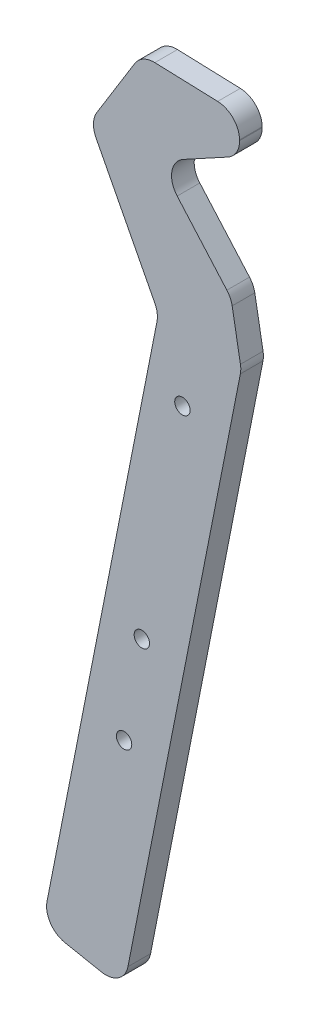
from build123d import *

# Parameters (mm, degrees)
SKETCH1_R           = 1.7
BOSS_EXTRUDE1_DEPTH = 5


with BuildPart() as part:
    # Sketch1 → Boss-Extrude1 (new body)
    with BuildSketch(Plane.XY):
        with BuildLine():
            Line((-6.070464182, 24.812225303), (-19.958071354, 25.288330369))
            ThreePointArc((-19.958071354, 25.288330369), (-22.490276705, 24.698780913), (-24.384131469, 22.917504226))
            Line((-24.384131469, 22.917504226), (-32.767669467, 9.335402505))
            ThreePointArc((-32.767669467, 9.335402505), (-33.509344938, 6.898271001), (-32.954010567, 4.412049729))
            Line((-32.954010567, 4.412049729), (-19.944783446, -20.739122704))
            ThreePointArc((-19.944783446, -20.739122704), (-19.435661169, -22.332379304), (-19.480501521, -24.004402458))
            Line((-19.480501521, -24.004402458), (-43.771872125, -147.080680186))
            ThreePointArc((-43.771872125, -147.080680186), (-43.019718624, -150.832869688), (-39.834667143, -152.954215487))
            Line((-39.834667143, -152.954215487), (-31.766323039, -154.546651824))
            ThreePointArc((-31.766323039, -154.546651824), (-28.014133538, -153.794498323), (-25.892787738, -150.609446842))
            Line((-25.892787738, -150.609446842), (-1.06250464, -24.802679145))
            ThreePointArc((-1.06250464, -24.802679145), (-0.968074634, -23.879218397), (-1.045977095, -22.954216783))
            Line((-1.045977095, -22.954216783), (-2.879406447, -12.703188307))
            ThreePointArc((-2.879406447, -12.703188307), (-3.295898049, -11.415233674), (-4.042598503, -10.286193895))
            Line((-4.042598503, -10.286193895), (-15.024159675, 2.232097065))
            ThreePointArc((-15.024159675, 2.232097065), (-16.188614474, 6.402596208), (-13.660892318, 9.918224001))
            Line((-13.660892318, 9.918224001), (-3.844891775, 15.275823833))
            ThreePointArc((-3.844891775, 15.275823833), (-1.928275453, 17.133614871), (-1.240561171, 19.712733856))
            Line((-1.240561171, 19.712733856), (-1.242008304, 19.86323568))
            ThreePointArc((-1.242008304, 19.86323568), (-2.662930088, 23.306844453), (-6.070464182, 24.812225303))
        make_face()
        with Locations((-13.865353247, -37.357391651)):
            Circle(SKETCH1_R, mode=Mode.SUBTRACT)
        with Locations((-26.748462507, -107.729710298)):
            Circle(SKETCH1_R, mode=Mode.SUBTRACT)
        with Locations((-22.825562759, -86.412593899)):
            Circle(SKETCH1_R, mode=Mode.SUBTRACT)
    extrude(amount=BOSS_EXTRUDE1_DEPTH)


solid = part.part
